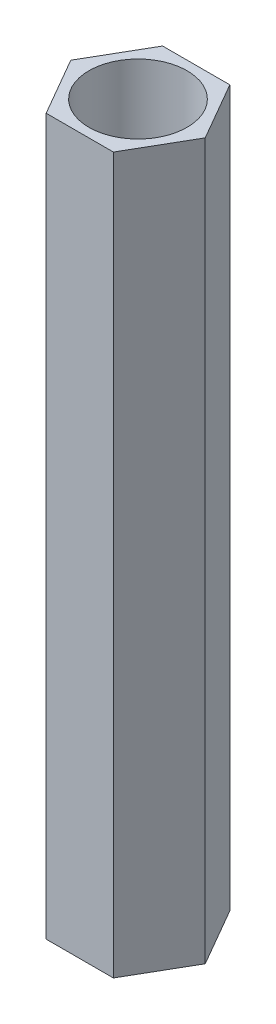
from build123d import *

# Parameters (mm, degrees)
CROQUIS1_R              = 1.825
SALIENTE_EXTRUIR1_DEPTH = 26.6


with BuildPart() as part:
    # Croquis1 → Saliente-Extruir1 (new body)
    with BuildSketch(Plane(origin=(0, 0, 0), x_dir=(1, 0, 0), z_dir=(0, 1, 0))):
        Polygon((2.5, 0), (1.25, 2.165063509), (-1.25, 2.165063509), (-2.5, 0), (-1.25, -2.165063509), (1.25, -2.165063509), align=None)
        with Locations(Location((0, 0, 0), (0, 0, 270))):
            Circle(CROQUIS1_R, mode=Mode.SUBTRACT)
    extrude(amount=SALIENTE_EXTRUIR1_DEPTH)


solid = part.part
